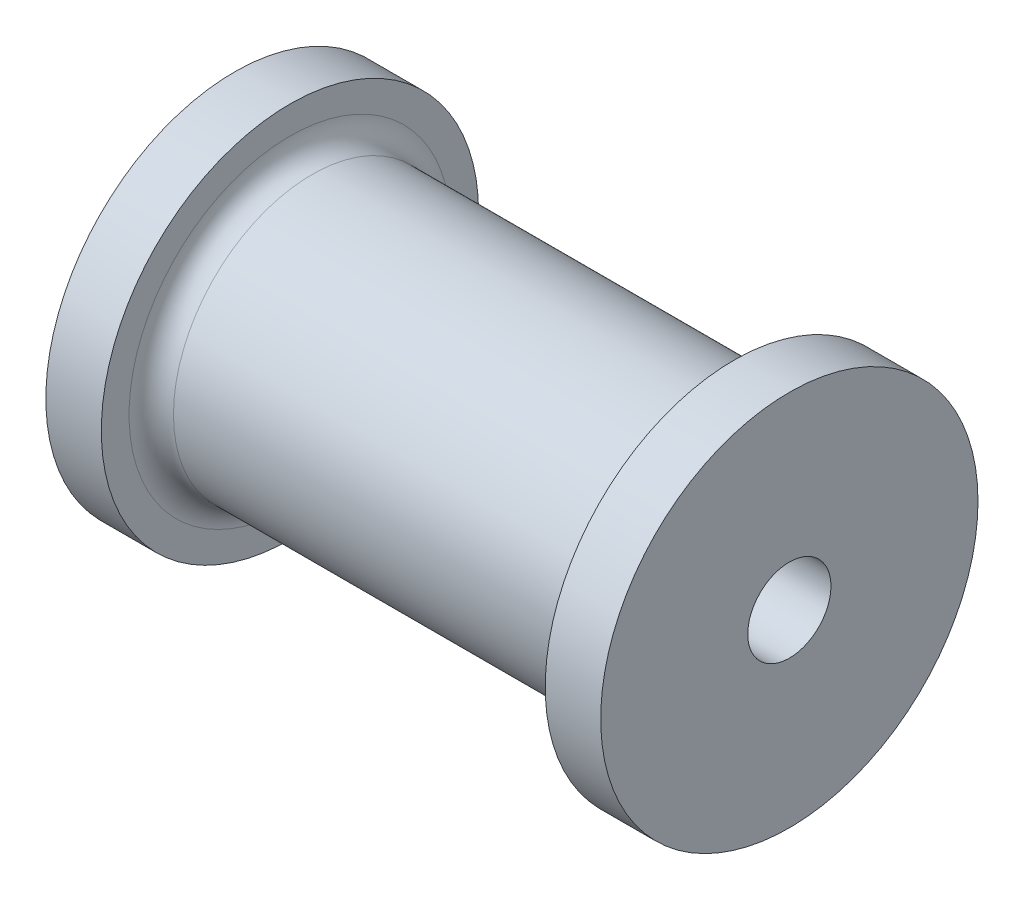
from build123d import *

# Parameters (mm, degrees)
SKETCH1_R           = 21.59
BOSS_EXTRUDE1_DEPTH = 6.35
SKETCH2_R           = 15.875
BOSS_EXTRUDE2_DEPTH = 50.8
FILLET1_R           = 2.54
SKETCH3_R           = 21.59
BOSS_EXTRUDE3_DEPTH = 6.35
FILLET2_R           = 2.54
SKETCH4_R           = 4.7625
CUT_EXTRUDE1_DEPTH  = 71.459252054


with BuildPart() as part:
    # Sketch1 → Boss-Extrude1 (new body)
    with BuildSketch(Plane(origin=(0, 0, 0), x_dir=(0, 0, -1), z_dir=(1, 0, 0))):
        Circle(SKETCH1_R)
    extrude(amount=BOSS_EXTRUDE1_DEPTH)

    # Sketch2 → Boss-Extrude2 (add)
    with BuildSketch(Plane(origin=(6.35, 0, 0), x_dir=(0, 0, -1), z_dir=(1, 0, 0))):
        Circle(SKETCH2_R)
    extrude(amount=BOSS_EXTRUDE2_DEPTH)

    # Fillet1
    fillet1_edges = [part.edges().sort_by_distance(p)[0] for p in [
        (6.35, 0, 15.875),
    ]]
    fillet(fillet1_edges, radius=FILLET1_R)

    # Sketch3 → Boss-Extrude3 (add)
    with BuildSketch(Plane(origin=(57.15, 0, 0), x_dir=(0, 0, -1), z_dir=(1, 0, 0))):
        Circle(SKETCH3_R)
    extrude(amount=BOSS_EXTRUDE3_DEPTH)

    # Fillet2
    fillet2_edges = [part.edges().sort_by_distance(p)[0] for p in [
        (57.15, 0, 15.875),
    ]]
    fillet(fillet2_edges, radius=FILLET2_R)

    # Sketch4 → Cut-Extrude1 (cut, through all)
    with BuildSketch(Plane(origin=(63.5, 0, 0), x_dir=(0, 0, -1), z_dir=(1, 0, 0))):
        Circle(SKETCH4_R)
    extrude(amount=-CUT_EXTRUDE1_DEPTH, mode=Mode.SUBTRACT)


solid = part.part
